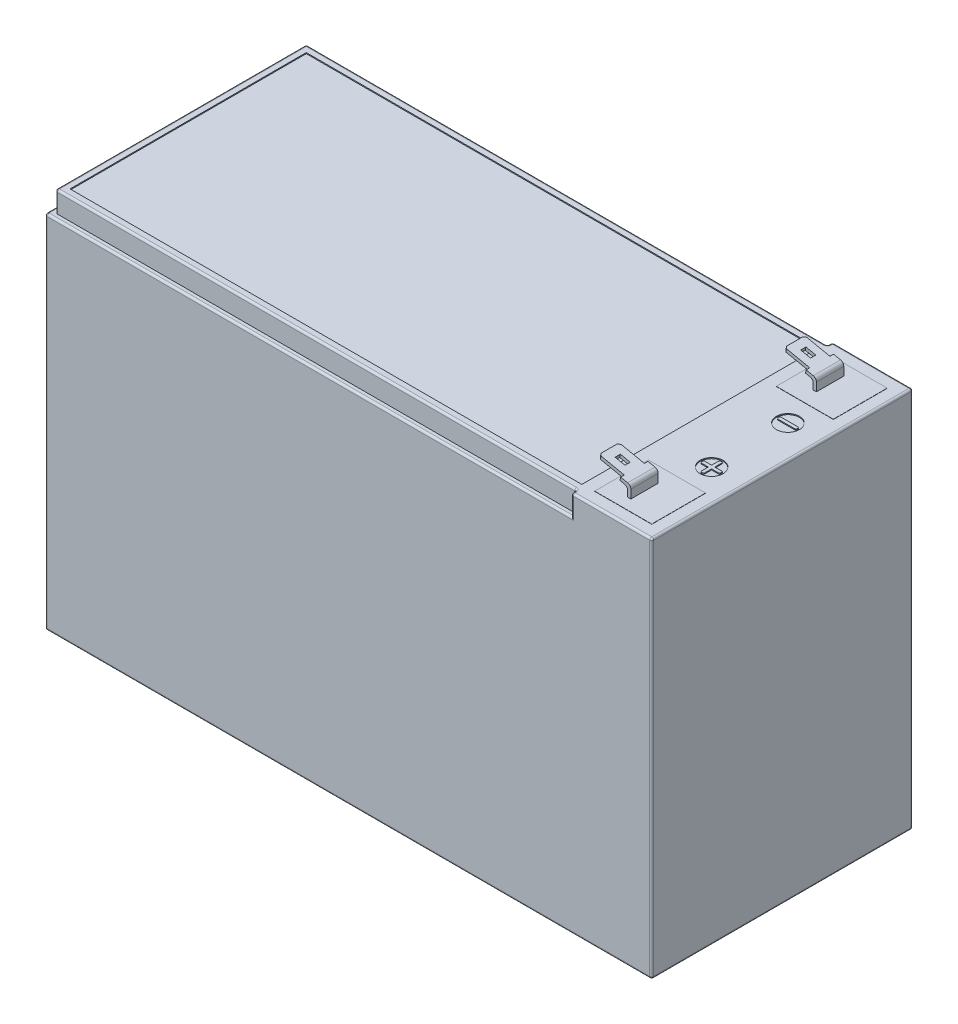
from build123d import *

# Parameters (mm, degrees)
SKETCH1_W                = 151
SKETCH1_H                = 65
BOSS_EXTRUDE1_DEPTH      = 95
BOSS_EXTRUDE2_DEPTH      = 6.8
CUT_EXTRUDE1_REACH       = 152.942
SKETCH4_W                = 6.4
SKETCH4_H                = 0.9
SKETCH4_W_2              = 2.5
SKETCH4_H_2              = 1.3
CHAMFER1_SIZE            = 0.5
FILLET1_R                = 1
CHAMFER1_OF_MIRROR1_SIZE = 0.5
FILLET1_OF_MIRROR1_R     = 1
CUT_EXTRUDE2_DEPTH       = 5.2
FILLET2_R                = 0.5
SKETCH6_R                = 2.875
SKETCH6_W                = 127.4
SKETCH6_H                = 58.8
SKETCH6_W_2              = 14.2
SKETCH6_H_2              = 13.4
CUT_EXTRUDE3_DEPTH       = 0.25
SKETCH7_W                = 14.2
SKETCH7_H                = 13.4
BOSS_EXTRUDE3_DEPTH      = 0.3
SKETCH8_W                = 14.2
SKETCH8_H                = 13.4
BOSS_EXTRUDE4_DEPTH      = 0.3
BOSS_EXTRUDE5_DEPTH      = 0.5
MIRROR3_COPY_1_DEPTH     = 0.5


with BuildPart() as part:
    # Sketch1 → Boss-Extrude1 (new body)
    with BuildSketch(Plane(origin=(0, 0, 0), x_dir=(1, 0, 0), z_dir=(0, 1, 0))):
        with Locations((0.44359577, 11.061104583)):
            Rectangle(SKETCH1_W, SKETCH1_H)
    extrude(amount=BOSS_EXTRUDE1_DEPTH)

    # Sketch2 → Boss-Extrude2 (add)
    with BuildSketch(Plane.XY.offset(15.438895417)):
        Polygon((63.94359577, 95), (63.94359577, 97.325729645), (55.769774606, 99.029953582), (55.933061472, 99.813112186), (64.74359577, 97.976134945), (64.74359577, 95), align=None)
    boss_extrude2 = extrude(amount=-BOSS_EXTRUDE2_DEPTH)

    # Sketch4 → Cut-Extrude1 (cut, up to next)
    with BuildSketch(Plane(origin=(22.274020552, 106.830949022, 0), x_dir=(0.9789482553235616, -0.204108582374566, 0), z_dir=(0.204108582374566, 0.9789482553235616, 0)), mode=Mode.PRIVATE) as cut_extrude1_sk1:
        with Locations((37.582860112, -9.088895417)):
            Rectangle(SKETCH4_W, SKETCH4_H)
    cut_extrude1_tool1 = extrude(cut_extrude1_sk1.sketch, amount=-CUT_EXTRUDE1_REACH, mode=Mode.PRIVATE) & part.part
    # Sketch4 → Cut-Extrude1 (cut, up to next)
    with BuildSketch(Plane(origin=(22.274020552, 106.830949022, 0), x_dir=(0.9789482553235616, -0.204108582374566, 0), z_dir=(0.204108582374566, 0.9789482553235616, 0)), mode=Mode.PRIVATE) as cut_extrude1_sk2:
        with Locations((37.582860112, -14.988895417)):
            Rectangle(SKETCH4_W, SKETCH4_H)
    cut_extrude1_tool2 = extrude(cut_extrude1_sk2.sketch, amount=-CUT_EXTRUDE1_REACH, mode=Mode.PRIVATE) & part.part
    # Sketch4 → Cut-Extrude1 (cut, up to next)
    with BuildSketch(Plane(origin=(22.274020552, 106.830949022, 0), x_dir=(0.9789482553235616, -0.204108582374566, 0), z_dir=(0.204108582374566, 0.9789482553235616, 0)), mode=Mode.PRIVATE) as cut_extrude1_sk3:
        with Locations((37.832860112, -12.038895417)):
            Rectangle(SKETCH4_W_2, SKETCH4_H_2)
    cut_extrude1_tool3 = extrude(cut_extrude1_sk3.sketch, amount=-CUT_EXTRUDE1_REACH, mode=Mode.PRIVATE) & part.part
    cut_extrude1_1 = cut_extrude1_tool1.solids().sort_by_distance((59.065696, 99.159965, 9.088895))[0]
    add(cut_extrude1_1, mode=Mode.SUBTRACT)
    cut_extrude1_2 = cut_extrude1_tool2.solids().sort_by_distance((59.065696, 99.159965, 14.988895))[0]
    add(cut_extrude1_2, mode=Mode.SUBTRACT)
    cut_extrude1_3 = cut_extrude1_tool3.solids().sort_by_distance((59.310433, 99.108938, 12.038895))[0]
    add(cut_extrude1_3, mode=Mode.SUBTRACT)
    cut_extrude1 = cut_extrude1_1 + cut_extrude1_2 + cut_extrude1_3  # Cut-Extrude1 as one shape, for the pattern or mirror that repeats it

    # Chamfer1
    chamfer1_edges = [part.edges().sort_by_distance(p)[0] for p in [
        (55.851418039, 99.421532884, 9.538895417),
        (55.851418039, 99.421532884, 14.538895417),
    ]]
    chamfer(chamfer1_edges, length=CHAMFER1_SIZE)

    # Fillet1
    fillet1_edges = [part.edges().sort_by_distance(p)[0] for p in [
        (63.94359577, 97.325729645, 12.038895417),
        (64.74359577, 97.976134945, 12.038895417),
    ]]
    fillet(fillet1_edges, radius=FILLET1_R)

    # Mirror1: Boss-Extrude2, Cut-Extrude1 across plane
    add(boss_extrude2.mirror(Plane.XY.offset(-11.061104583)))
    add(cut_extrude1.mirror(Plane.XY.offset(-11.061104583)), mode=Mode.SUBTRACT)

    # Chamfer1 of Mirror1
    chamfer1_of_mirror1_edges = [part.edges().sort_by_distance(p)[0] for p in [
        (55.851418039, 99.421532884, -31.661104583),
        (55.851418039, 99.421532884, -36.661104583),
    ]]
    chamfer(chamfer1_of_mirror1_edges, length=CHAMFER1_OF_MIRROR1_SIZE)

    # Fillet1 of Mirror1
    fillet1_of_mirror1_edges = [part.edges().sort_by_distance(p)[0] for p in [
        (63.94359577, 97.325729645, -34.161104583),
        (64.74359577, 97.976134945, -34.161104583),
    ]]
    fillet(fillet1_of_mirror1_edges, radius=FILLET1_OF_MIRROR1_R)

    # Sketch5 → Cut-Extrude2 (cut)
    with BuildSketch(Plane(origin=(0, 95, 0), x_dir=(1, 0, 0), z_dir=(0, 1, 0))):
        Polygon((55.94359577, -21.438895417), (55.94359577, -20.138895417), (-73.75640423, -20.138895417), (-73.75640423, 42.261104583), (55.94359577, 42.261104583), (55.94359577, 43.561104583), (-75.05640423, 43.561104583), (-75.05640423, -21.438895417), align=None)
    extrude(amount=-CUT_EXTRUDE2_DEPTH, mode=Mode.SUBTRACT)

    # Fillet2
    fillet2_edges = [part.edges().sort_by_distance(p)[0] for p in [
        (75.94359577, 95, -11.061104583),
        (65.94359577, 95, -43.561104583),
        (65.94359577, 95, 21.438895417),
        (-75.05640423, 44.9, -43.561104583),
        (-75.05640423, 44.9, 21.438895417),
        (-9.55640423, 89.8, 21.438895417),
        (55.94359577, 92.4, 21.438895417),
        (-75.05640423, 89.8, -11.061104583),
        (-9.55640423, 89.8, -43.561104583),
        (55.94359577, 92.4, -43.561104583),
        (55.94359577, 92.4, -42.261104583),
        (-73.75640423, 92.4, -42.261104583),
        (-73.75640423, 92.4, 20.138895417),
        (55.94359577, 92.4, 20.138895417),
        (55.94359577, 95, 20.788895417),
        (-8.90640423, 95, 20.138895417),
        (-73.75640423, 95, -11.061104583),
        (-8.90640423, 95, -42.261104583),
        (55.94359577, 95, -42.911104583),
        (0.44359577, 0, -43.561104583),
        (75.94359577, 0, -11.061104583),
        (0.44359577, 0, 21.438895417),
        (-75.05640423, 0, -11.061104583),
        (75.94359577, 47.5, -43.561104583),
        (75.94359577, 47.5, 21.438895417),
    ]]
    fillet(fillet2_edges, radius=FILLET2_R)

    # Sketch6 → Cut-Extrude3 (cut)
    # profile 1 of 5: a face of its own
    with BuildSketch(Plane(origin=(0, 95, 0), x_dir=(1, 0, 0), z_dir=(0, 1, 0))):
        with Locations(Location((67.84359577, 20.561104583, 0), (0, 0, 270))):
            Circle(SKETCH6_R)
        with BuildLine():
            Line((65.69359577, 20.961104583), (69.99359577, 20.961104583))
            ThreePointArc((69.99359577, 20.961104583), (70.170372465, 20.887881278), (70.24359577, 20.711104583))
            Line((70.24359577, 20.711104583), (70.24359577, 20.411104583))
            ThreePointArc((70.24359577, 20.411104583), (70.170372465, 20.234327888), (69.99359577, 20.161104583))
            Line((69.99359577, 20.161104583), (65.69359577, 20.161104583))
            ThreePointArc((65.69359577, 20.161104583), (65.516819074, 20.234327888), (65.44359577, 20.411104583))
            Line((65.44359577, 20.411104583), (65.44359577, 20.711104583))
            ThreePointArc((65.44359577, 20.711104583), (65.516819074, 20.887881278), (65.69359577, 20.961104583))
        make_face(mode=Mode.SUBTRACT)
    # profile 2 of 5: a face of its own
    with BuildSketch(Plane(origin=(0, 95, 0), x_dir=(1, 0, 0), z_dir=(0, 1, 0))):
        with Locations(Location((67.84359577, 1.561104583, 0), (0, 0, 270))):
            Circle(SKETCH6_R)
        with BuildLine():
            Line((67.44359577, 3.711104583), (67.44359577, 1.961104583))
            Line((67.44359577, 1.961104583), (65.69359577, 1.961104583))
            ThreePointArc((65.69359577, 1.961104583), (65.516819074, 1.887881278), (65.44359577, 1.711104583))
            Line((65.44359577, 1.711104583), (65.44359577, 1.411104583))
            ThreePointArc((65.44359577, 1.411104583), (65.516819074, 1.234327888), (65.69359577, 1.161104583))
            Line((65.69359577, 1.161104583), (67.44359577, 1.161104583))
            Line((67.44359577, 1.161104583), (67.44359577, -0.588895417))
            ThreePointArc((67.44359577, -0.588895417), (67.516819074, -0.765672112), (67.69359577, -0.838895417))
            Line((67.69359577, -0.838895417), (67.99359577, -0.838895417))
            ThreePointArc((67.99359577, -0.838895417), (68.170372465, -0.765672112), (68.24359577, -0.588895417))
            Line((68.24359577, -0.588895417), (68.24359577, 1.161104583))
            Line((68.24359577, 1.161104583), (69.99359577, 1.161104583))
            ThreePointArc((69.99359577, 1.161104583), (70.170372465, 1.234327888), (70.24359577, 1.411104583))
            Line((70.24359577, 1.411104583), (70.24359577, 1.711104583))
            ThreePointArc((70.24359577, 1.711104583), (70.170372465, 1.887881278), (69.99359577, 1.961104583))
            Line((69.99359577, 1.961104583), (68.24359577, 1.961104583))
            Line((68.24359577, 1.961104583), (68.24359577, 3.711104583))
            ThreePointArc((68.24359577, 3.711104583), (68.170372465, 3.887881278), (67.99359577, 3.961104583))
            Line((67.99359577, 3.961104583), (67.69359577, 3.961104583))
            ThreePointArc((67.69359577, 3.961104583), (67.516819074, 3.887881278), (67.44359577, 3.711104583))
        make_face(mode=Mode.SUBTRACT)
    # profile 3 of 5: a face of its own
    with BuildSketch(Plane(origin=(0, 95, 0), x_dir=(1, 0, 0), z_dir=(0, 1, 0))):
        with Locations((-8.25640423, 11.061104583)):
            Rectangle(SKETCH6_W, SKETCH6_H)
    # profile 4 of 5: a face of its own
    with BuildSketch(Plane(origin=(0, 95, 0), x_dir=(1, 0, 0), z_dir=(0, 1, 0))):
        with Locations((65.64359577, 33.661104583)):
            Rectangle(SKETCH6_W_2, SKETCH6_H_2)
    # profile 5 of 5: a face of its own
    with BuildSketch(Plane(origin=(0, 95, 0), x_dir=(1, 0, 0), z_dir=(0, 1, 0))):
        with Locations((65.64359577, -11.538895417)):
            Rectangle(SKETCH6_W_2, SKETCH6_H_2)
    extrude(amount=-CUT_EXTRUDE3_DEPTH, mode=Mode.SUBTRACT)


with BuildPart() as cut_extrude3_piece_1:
    # of the separate pieces the step leaves, piece 1, a body of its own (cut_extrude3_pieces)
    add(part.part.solids().sort_by_distance((75.44359577, 95, -43.061104583))[0])



with BuildPart() as cut_extrude3_piece_2:
    # of the separate pieces the step leaves, piece 2, a body of its own (cut_extrude3_pieces)
    add(part.part.solids().sort_by_distance((63.94359577, 96.512723019, 15.438895417))[0])


with BuildPart() as cut_extrude3_piece_3:
    # of the separate pieces the step leaves, piece 3, a body of its own (cut_extrude3_pieces)
    add(part.part.solids().sort_by_distance((64.74359577, 97.16312832, -37.561104583))[0])


with BuildPart() as cut_extrude3_piece_1_1:
    add(cut_extrude3_piece_1.part)

    add(cut_extrude3_piece_3.part)  # Boss-Extrude3 merges Cut-Extrude3 piece 3
    # Sketch7 → Boss-Extrude3 (add)
    with BuildSketch(Plane(origin=(0, 94.75, 0), x_dir=(1, 0, 0), z_dir=(0, 1, 0))):
        with Locations((65.64359577, 33.661104583)):
            Rectangle(SKETCH7_W, SKETCH7_H)
    extrude(amount=BOSS_EXTRUDE3_DEPTH)


    add(cut_extrude3_piece_2.part)  # Boss-Extrude4 merges Cut-Extrude3 piece 2
    # Sketch8 → Boss-Extrude4 (add)
    with BuildSketch(Plane(origin=(0, 94.75, 0), x_dir=(1, 0, 0), z_dir=(0, 1, 0))):
        with Locations((65.64359577, -11.538895417)):
            Rectangle(SKETCH8_W, SKETCH8_H)
    extrude(amount=BOSS_EXTRUDE4_DEPTH)

    # Sketch9 → Boss-Extrude5 (add)
    with BuildSketch(Plane.XZ):
        with BuildLine():
            Line((-70.05640423, 8.738895417), (-70.05640423, 15.938895417))
            ThreePointArc((-70.05640423, 15.938895417), (-69.909957621, 16.292448808), (-69.55640423, 16.438895417))
            Line((-69.55640423, 16.438895417), (-62.35640423, 16.438895417))
            ThreePointArc((-62.35640423, 16.438895417), (-62.00285084, 16.292448808), (-61.85640423, 15.938895417))
            Line((-61.85640423, 15.938895417), (-61.85640423, 14.938895417))
            ThreePointArc((-61.85640423, 14.938895417), (-62.00285084, 14.585342027), (-62.35640423, 14.438895417))
            Line((-62.35640423, 14.438895417), (-68.05640423, 14.438895417))
            Line((-68.05640423, 14.438895417), (-68.05640423, 8.738895417))
            ThreePointArc((-68.05640423, 8.738895417), (-68.20285084, 8.385342027), (-68.55640423, 8.238895417))
            Line((-68.55640423, 8.238895417), (-69.55640423, 8.238895417))
            ThreePointArc((-69.55640423, 8.238895417), (-69.909957621, 8.385342027), (-70.05640423, 8.738895417))
        make_face()
    boss_extrude5 = extrude(amount=BOSS_EXTRUDE5_DEPTH)

    # Mirror2: Boss-Extrude5 across plane
    add(boss_extrude5.mirror(Plane.ZY.offset(-0.44359577)))

    # Mirror3: Boss-Extrude5 across plane
    add(boss_extrude5.mirror(Plane.XY.offset(-11.061104583)))

    # Mirror3 copy 1 sketch → Mirror3 copy 1 (add)
    with BuildSketch(Plane(origin=(0.887191539, 0, -22.122209166), x_dir=(-1, 0, 0), z_dir=(0, -1, 0))):
        with BuildLine():
            Line((-70.05640423, 8.738895417), (-70.05640423, 15.938895417))
            ThreePointArc((-70.05640423, 15.938895417), (-69.909957621, 16.292448808), (-69.55640423, 16.438895417))
            Line((-69.55640423, 16.438895417), (-62.35640423, 16.438895417))
            ThreePointArc((-62.35640423, 16.438895417), (-62.00285084, 16.292448808), (-61.85640423, 15.938895417))
            Line((-61.85640423, 15.938895417), (-61.85640423, 14.938895417))
            ThreePointArc((-61.85640423, 14.938895417), (-62.00285084, 14.585342027), (-62.35640423, 14.438895417))
            Line((-62.35640423, 14.438895417), (-68.05640423, 14.438895417))
            Line((-68.05640423, 14.438895417), (-68.05640423, 8.738895417))
            ThreePointArc((-68.05640423, 8.738895417), (-68.20285084, 8.385342027), (-68.55640423, 8.238895417))
            Line((-68.55640423, 8.238895417), (-69.55640423, 8.238895417))
            ThreePointArc((-69.55640423, 8.238895417), (-69.909957621, 8.385342027), (-70.05640423, 8.738895417))
        make_face()
    extrude(amount=MIRROR3_COPY_1_DEPTH)


solid = cut_extrude3_piece_1_1.part
